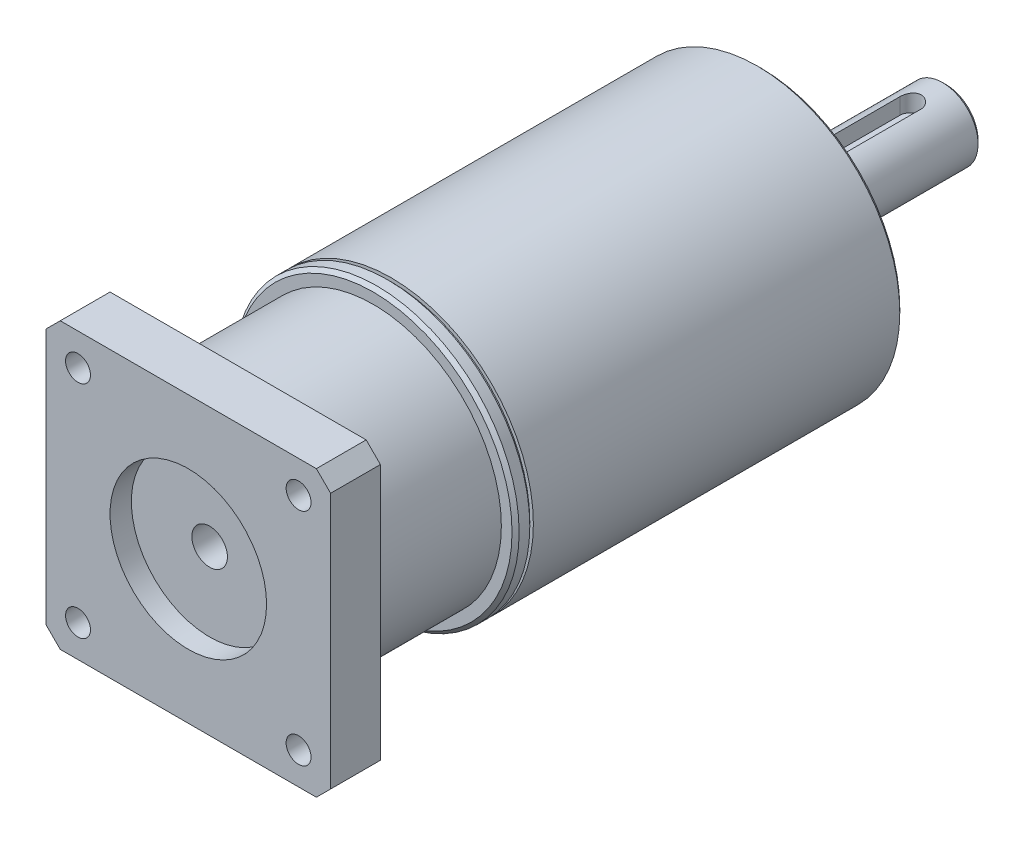
from build123d import *

# Parameters (mm, degrees)
SKETCH_1_W               = 40
SKETCH_1_H               = 40
EXTRUDE_1_DEPTH          = 7
SKETCH_2_R               = 18
EXTRUDE_2_DEPTH          = 26
SKETCH_3_R               = 20
EXTRUDE_3_DEPTH          = 54.5
SKETCH_4_W               = 2.306133039
SKETCH_4_H               = 0.5
SKETCH_5_R               = 13
EXTRUDE_4_DEPTH          = 2
SKETCH_6_R               = 6
EXTRUDE_5_DEPTH          = 1
SKETCH_7_R               = 5
EXTRUDE_6_DEPTH          = 23
CHAMFER_1_SIZE           = 2
CHAMFER_2_SIZE           = 0.5
SKETCH_8_R               = 1.75
CUT_EXTRUDE_1_DEPTH      = 20
PATTERN_CIRCULAR_1_COUNT = 4
SKETCH_9_R               = 11
CUT_EXTRUDE_2_DEPTH      = 3
SKETCH_10_R              = 2.5
CUT_EXTRUDE_3_DEPTH      = 23
PATTERN_CIRCULAR_2_COUNT = 4
CUT_EXTRUDE_4_DEPTH      = 2.5


with BuildPart() as part:
    # 草图1 → 凸台-拉伸1 (new body)
    with BuildSketch(Plane.XY):
        Rectangle(SKETCH_1_W, SKETCH_1_H)
    extrude(amount=EXTRUDE_1_DEPTH)

    # 草图2 → 凸台-拉伸2 (add)
    with BuildSketch(Plane.XY.offset(7)):
        Circle(SKETCH_2_R)
    extrude(amount=-EXTRUDE_2_DEPTH)

    # 草图3 → 凸台-拉伸3 (add)
    with BuildSketch(Plane(origin=(0, 0, -19), x_dir=(-1, 0, 0), z_dir=(0, 0, -1))):
        Circle(SKETCH_3_R)
    extrude(amount=EXTRUDE_3_DEPTH)

    # 草图4 → 切除-旋转1 (revolve, cut)
    with BuildSketch(Plane(origin=(0, 0, 0), x_dir=(1, 0, 0), z_dir=(0, 1, 0))):
        with Locations((20.65306652, 21.25)):
            Rectangle(SKETCH_4_W, SKETCH_4_H)
    revolve(axis=Axis((0, 0, 0), (0, 0, -1)), mode=Mode.SUBTRACT)

    # 草图5 → 凸台-拉伸4 (add)
    with BuildSketch(Plane(origin=(0, 0, -73.5), x_dir=(-1, 0, 0), z_dir=(0, 0, -1))):
        Circle(SKETCH_5_R)
    extrude(amount=EXTRUDE_4_DEPTH)

    # 草图6 → 凸台-拉伸5 (add)
    with BuildSketch(Plane(origin=(0, 0, -75.5), x_dir=(-1, 0, 0), z_dir=(0, 0, -1))):
        Circle(SKETCH_6_R)
    extrude(amount=EXTRUDE_5_DEPTH)

    # 草图7 → 凸台-拉伸6 (add)
    with BuildSketch(Plane(origin=(0, 0, -76.5), x_dir=(-1, 0, 0), z_dir=(0, 0, -1))):
        Circle(SKETCH_7_R)
    extrude(amount=EXTRUDE_6_DEPTH)

    # 倒角1
    chamfer_1_edges = [part.edges().sort_by_distance(p)[0] for p in [
        (20, -20, 3.5),
        (-20, -20, 3.5),
        (-20, 20, 3.5),
        (20, 20, 3.5),
    ]]
    chamfer(chamfer_1_edges, length=CHAMFER_1_SIZE)

    # 倒角2
    chamfer_2_edges = [part.edges().sort_by_distance(p)[0] for p in [
        (20, 0, -19),
        (20, 0, -73.5),
        (6, 0, -76.5),
        (5, 0, -99.5),
    ]]
    chamfer(chamfer_2_edges, length=CHAMFER_2_SIZE)

    # 草图8 → 切除-拉伸1 (cut)
    with BuildSketch(Plane.XY.offset(7)):
        with Locations((-15.5, 15.5)):
            Circle(SKETCH_8_R)
    cut_extrude_1 = extrude(amount=-CUT_EXTRUDE_1_DEPTH, mode=Mode.SUBTRACT)

    # 阵列(圆周)1: 切除-拉伸1 ×4 about axis
    pattern_circular_1_axis = Axis((0, 0, 0), (0, 0, 1))
    for i in range(1, PATTERN_CIRCULAR_1_COUNT):
        add(cut_extrude_1.rotate(pattern_circular_1_axis, i * 360 / PATTERN_CIRCULAR_1_COUNT), mode=Mode.SUBTRACT)

    # 草图9 → 切除-拉伸2 (cut)
    with BuildSketch(Plane.XY.offset(7)):
        Circle(SKETCH_9_R)
    extrude(amount=-CUT_EXTRUDE_2_DEPTH, mode=Mode.SUBTRACT)

    # 草图10 → 切除-拉伸3 (cut)
    with BuildSketch(Plane.XY.offset(4)):
        Circle(SKETCH_10_R)
    extrude(amount=-CUT_EXTRUDE_3_DEPTH, mode=Mode.SUBTRACT)

    # 草图11 → M4 螺纹孔1 (revolve, cut)
    with BuildSketch(Plane(origin=(-12.02081528, 12.02081528, -73.5), x_dir=(0, 1, 0), z_dir=(1, 0, 0))):
        Polygon((0, 0), (0, 10.991420021), (1.65, 10), (1.65, 0), align=None)
    hole_wizard_m4_1 = revolve(axis=Axis((-12.02081528, 12.02081528, -79.85), (0, 0, 1)), mode=Mode.SUBTRACT)

    # 阵列(圆周)2: M4 螺纹孔1 ×4 about axis
    pattern_circular_2_axis = Axis((0, 0, 0), (0, 0, 1))
    for i in range(1, PATTERN_CIRCULAR_2_COUNT):
        add(hole_wizard_m4_1.rotate(pattern_circular_2_axis, i * 360 / PATTERN_CIRCULAR_2_COUNT), mode=Mode.SUBTRACT)

    # 草图13 → 切除-拉伸4 (cut)
    with BuildSketch(Plane(origin=(0, 5, 0), x_dir=(1, 0, 0), z_dir=(0, 1, 0))):
        with BuildLine():
            Line((1.5, 94.5), (1.5, 81.5))
            ThreePointArc((1.5, 81.5), (0, 80), (-1.5, 81.5))
            Line((-1.5, 81.5), (-1.5, 94.5))
            ThreePointArc((-1.5, 94.5), (0, 96), (1.5, 94.5))
        make_face()
    extrude(amount=-CUT_EXTRUDE_4_DEPTH, mode=Mode.SUBTRACT)


solid = part.part
